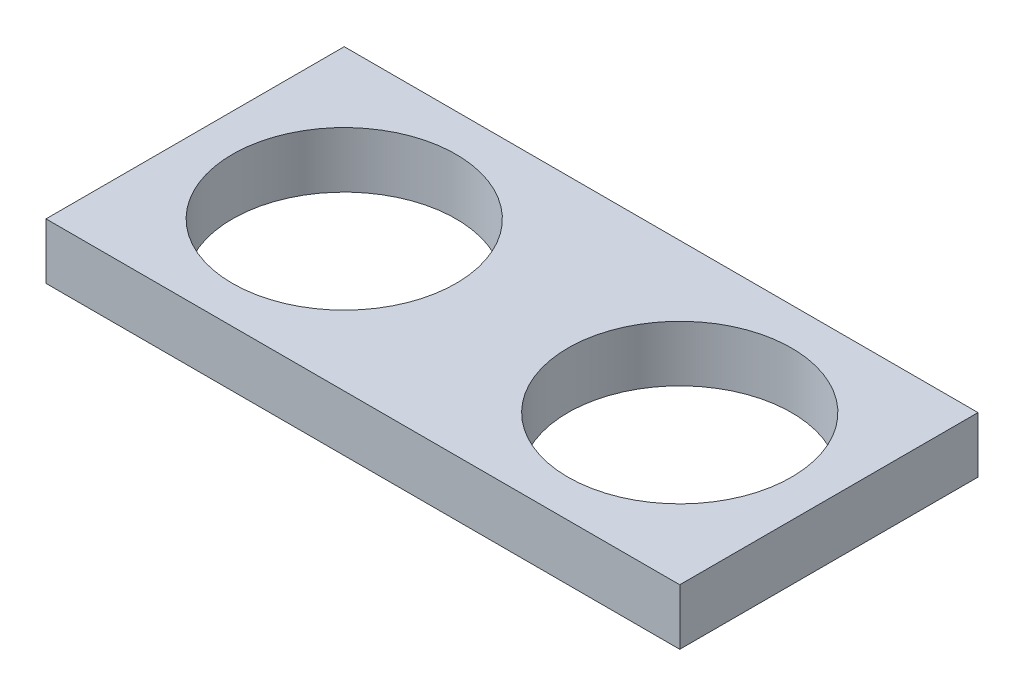
from build123d import *

# Parameters (mm, degrees)
SKETCH1_W           = 34
SKETCH1_H           = 16
SKETCH1_R           = 6
BOSS_EXTRUDE1_DEPTH = 3


with BuildPart() as part:
    # Sketch1 → Boss-Extrude1 (new body)
    with BuildSketch(Plane(origin=(0, 0, 0), x_dir=(1, 0, 0), z_dir=(0, 1, 0))):
        with Locations((17, 8)):
            Rectangle(SKETCH1_W, SKETCH1_H)
        with Locations(Location((8, 8, 0), (0, 0, 270))):
            Circle(SKETCH1_R, mode=Mode.SUBTRACT)
        with Locations(Location((26, 8, 0), (0, 0, 270))):
            Circle(SKETCH1_R, mode=Mode.SUBTRACT)
    extrude(amount=BOSS_EXTRUDE1_DEPTH)


solid = part.part
